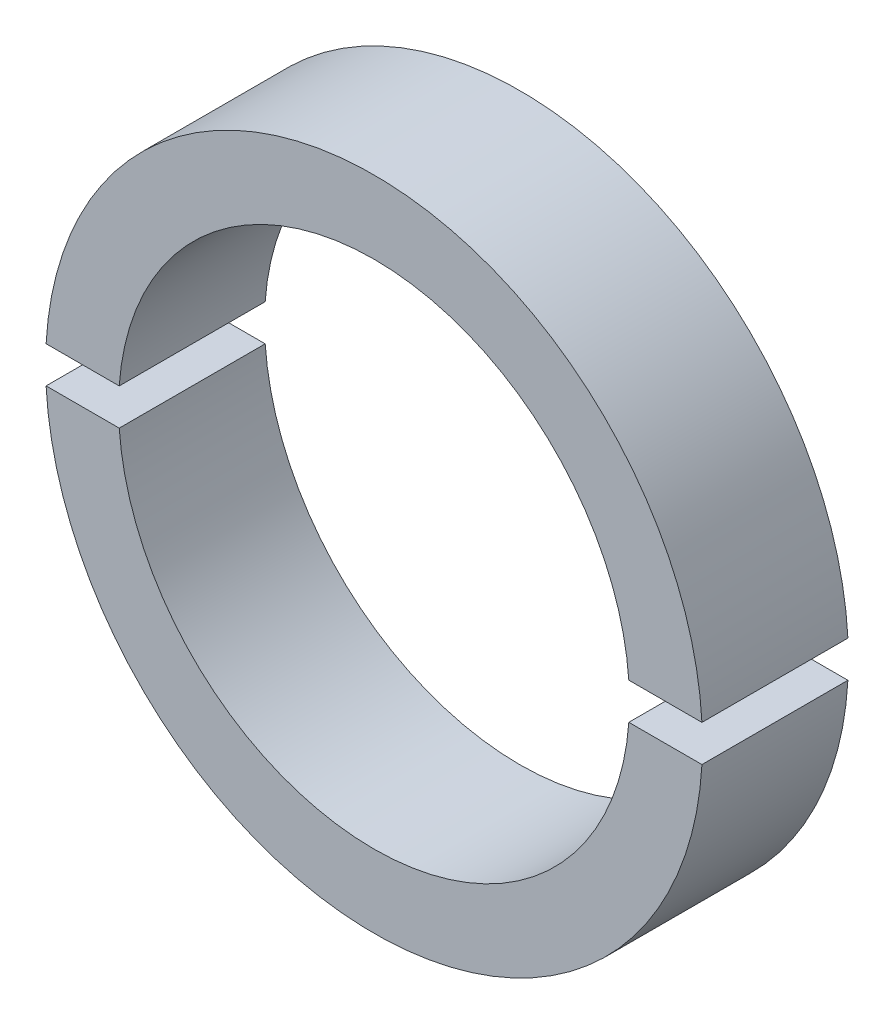
from build123d import *

# Parameters (mm, degrees)
SKIZZE1_R                       = 9
SKIZZE1_R_2                     = 7
AUFSATZ_LINEAR_AUSTRAGEN1_DEPTH = 4
SKIZZE2_W                       = 27.54683789
SKIZZE2_H                       = 1
SCHNITT_LINEAR_AUSTRAGEN1_DEPTH = 10


with BuildPart() as part:
    # Skizze1 → Aufsatz-Linear austragen1 (new body)
    with BuildSketch(Plane.XY):
        Circle(SKIZZE1_R)
        Circle(SKIZZE1_R_2, mode=Mode.SUBTRACT)
    extrude(amount=AUFSATZ_LINEAR_AUSTRAGEN1_DEPTH)

    # Skizze2 → Schnitt-Linear austragen1 (cut)
    with BuildSketch(Plane.XY.offset(4)):
        Rectangle(SKIZZE2_W, SKIZZE2_H)
    extrude(amount=-SCHNITT_LINEAR_AUSTRAGEN1_DEPTH, mode=Mode.SUBTRACT)


with BuildPart() as schnitt_linear_austragen1_piece_1:
    # of the separate pieces the step leaves, piece 1, a body of its own (schnitt_linear_austragen1_pieces)
    add(part.part.solids().sort_by_distance((-8.986100378, -0.5, 0))[0])


with BuildPart() as schnitt_linear_austragen1_piece_2:
    # of the separate pieces the step leaves, piece 2, a body of its own (schnitt_linear_austragen1_pieces)
    add(part.part.solids().sort_by_distance((8.986100378, 0.5, 0))[0])


solid = Compound([schnitt_linear_austragen1_piece_1.part, schnitt_linear_austragen1_piece_2.part])
